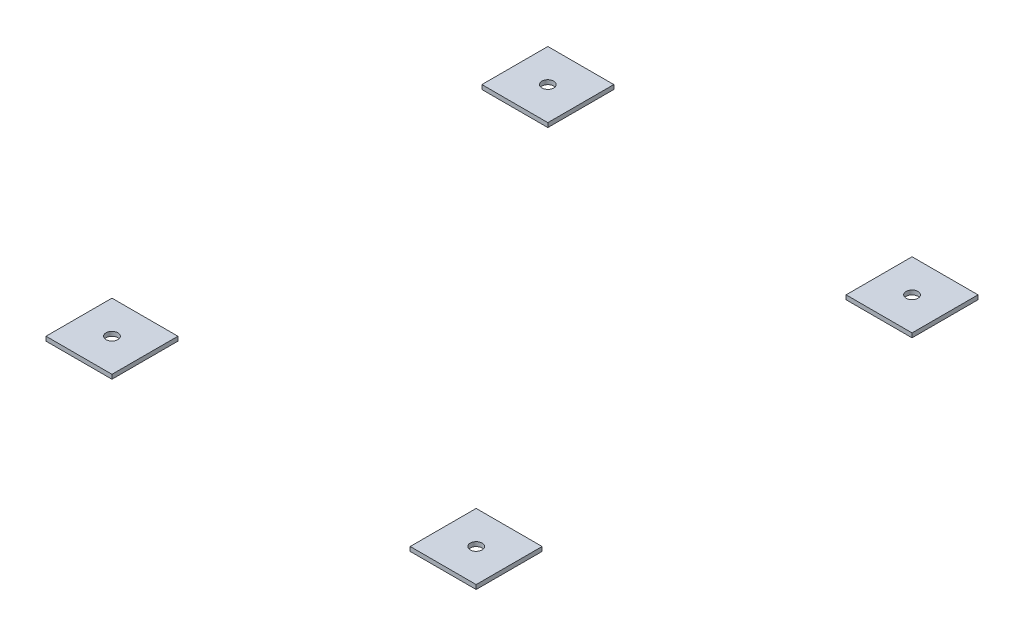
from build123d import *

# Parameters (mm, degrees)
SKETCH1_W                            = 46
SKETCH1_H                            = 46
SKETCH1_R                            = 4.14
ELECTRONICS_TRAY_CORNER_TABS_DEPTH   = 1.5
ELECTRONICS_TRAY_CORNER_TABS_2_DEPTH = 1.5
ELECTRONICS_TRAY_CORNER_TABS_3_DEPTH = 1.5
ELECTRONICS_TRAY_CORNER_TABS_4_DEPTH = 1.5


with BuildPart() as part:
    # Sketch1 → Electronics tray corner tabs (new, symmetric)
    with BuildSketch(Plane(origin=(0, 0, 0), x_dir=(1, 0, 0), z_dir=(0, 1, 0))):
        with Locations((127, 152)):
            Rectangle(SKETCH1_W, SKETCH1_H)
        with Locations(Location((127, 152, 0), (0, 0, 270))):
            Circle(SKETCH1_R, mode=Mode.SUBTRACT)
    extrude(amount=ELECTRONICS_TRAY_CORNER_TABS_DEPTH, both=True)


with BuildPart() as body_2:
    # Sketch1 → Electronics tray corner tabs 2 (new, symmetric)
    with BuildSketch(Plane(origin=(0, 0, 0), x_dir=(1, 0, 0), z_dir=(0, 1, 0))):
        with Locations((-127, 152)):
            Rectangle(SKETCH1_W, SKETCH1_H)
        with Locations(Location((-127, 152, 0), (0, 0, 270))):
            Circle(SKETCH1_R, mode=Mode.SUBTRACT)
    extrude(amount=ELECTRONICS_TRAY_CORNER_TABS_2_DEPTH, both=True)


with BuildPart() as body_3:
    # Sketch1 → Electronics tray corner tabs 3 (new, symmetric)
    with BuildSketch(Plane(origin=(0, 0, 0), x_dir=(1, 0, 0), z_dir=(0, 1, 0))):
        with Locations((127, -152)):
            Rectangle(SKETCH1_W, SKETCH1_H)
        with Locations(Location((127, -152, 0), (0, 0, 270))):
            Circle(SKETCH1_R, mode=Mode.SUBTRACT)
    extrude(amount=ELECTRONICS_TRAY_CORNER_TABS_3_DEPTH, both=True)


with BuildPart() as body_4:
    # Sketch1 → Electronics tray corner tabs 4 (new, symmetric)
    with BuildSketch(Plane(origin=(0, 0, 0), x_dir=(1, 0, 0), z_dir=(0, 1, 0))):
        with Locations((-127, -152)):
            Rectangle(SKETCH1_W, SKETCH1_H)
        with Locations(Location((-127, -152, 0), (0, 0, 270))):
            Circle(SKETCH1_R, mode=Mode.SUBTRACT)
    extrude(amount=ELECTRONICS_TRAY_CORNER_TABS_4_DEPTH, both=True)


solid = Compound([part.part, body_2.part, body_3.part, body_4.part])
